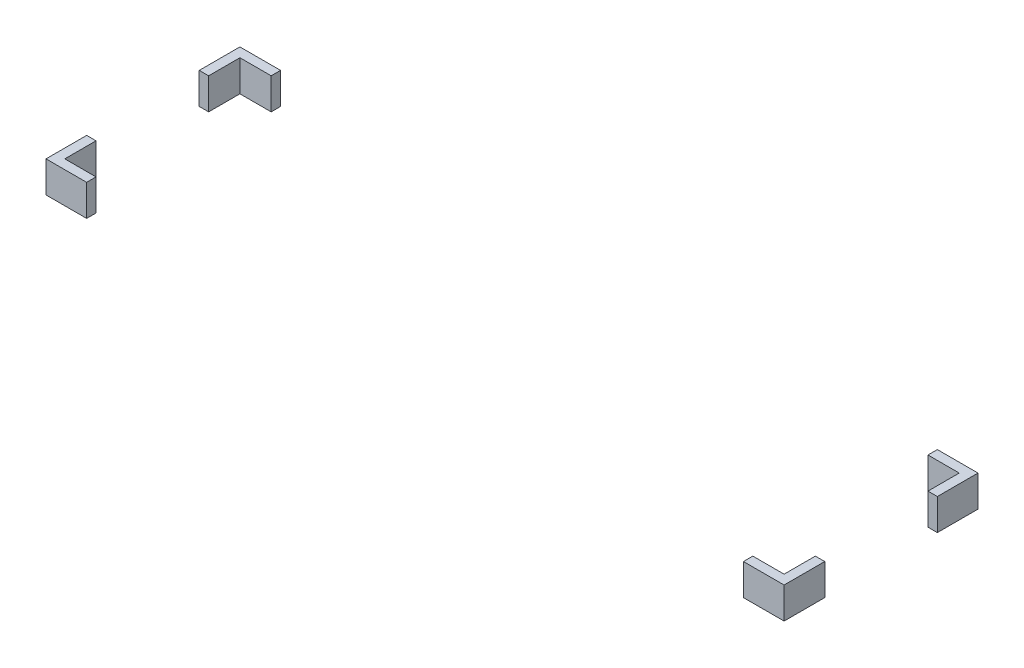
from build123d import *

# Parameters (mm, degrees)
BOSS_EXTRUDE1_DEPTH   = 5
BOSS_EXTRUDE1_2_DEPTH = 5
BOSS_EXTRUDE1_3_DEPTH = 5
BOSS_EXTRUDE1_4_DEPTH = 5


with BuildPart() as part:
    # Sketch1 → Boss-Extrude1 (new body)
    with BuildSketch(Plane(origin=(0, 0, 0), x_dir=(1, 0, 0), z_dir=(0, 1, 0))):
        Polygon((-57.5, 9), (-57.5, 14), (-52.5, 14), (-52.5, 15.5), (-59, 15.5), (-59, 9), align=None)
    extrude(amount=BOSS_EXTRUDE1_DEPTH)


with BuildPart() as body_2:
    # Sketch1 → Boss-Extrude1 2 (new body)
    with BuildSketch(Plane(origin=(0, 0, 0), x_dir=(1, 0, 0), z_dir=(0, 1, 0))):
        Polygon((52.5, 14), (57.5, 14), (57.5, 9), (59, 9), (59, 15.5), (52.5, 15.5), align=None)
    extrude(amount=BOSS_EXTRUDE1_2_DEPTH)


with BuildPart() as body_3:
    # Sketch1 → Boss-Extrude1 3 (new body)
    with BuildSketch(Plane(origin=(0, 0, 0), x_dir=(1, 0, 0), z_dir=(0, 1, 0))):
        Polygon((57.5, -9), (57.5, -14), (52.5, -14), (52.5, -15.5), (59, -15.5), (59, -9), align=None)
    extrude(amount=BOSS_EXTRUDE1_3_DEPTH)


with BuildPart() as body_4:
    # Sketch1 → Boss-Extrude1 4 (new body)
    with BuildSketch(Plane(origin=(0, 0, 0), x_dir=(1, 0, 0), z_dir=(0, 1, 0))):
        Polygon((-52.5, -14), (-57.5, -14), (-57.5, -9), (-59, -9), (-59, -15.5), (-52.5, -15.5), align=None)
    extrude(amount=BOSS_EXTRUDE1_4_DEPTH)


solid = Compound([part.part, body_2.part, body_3.part, body_4.part])
